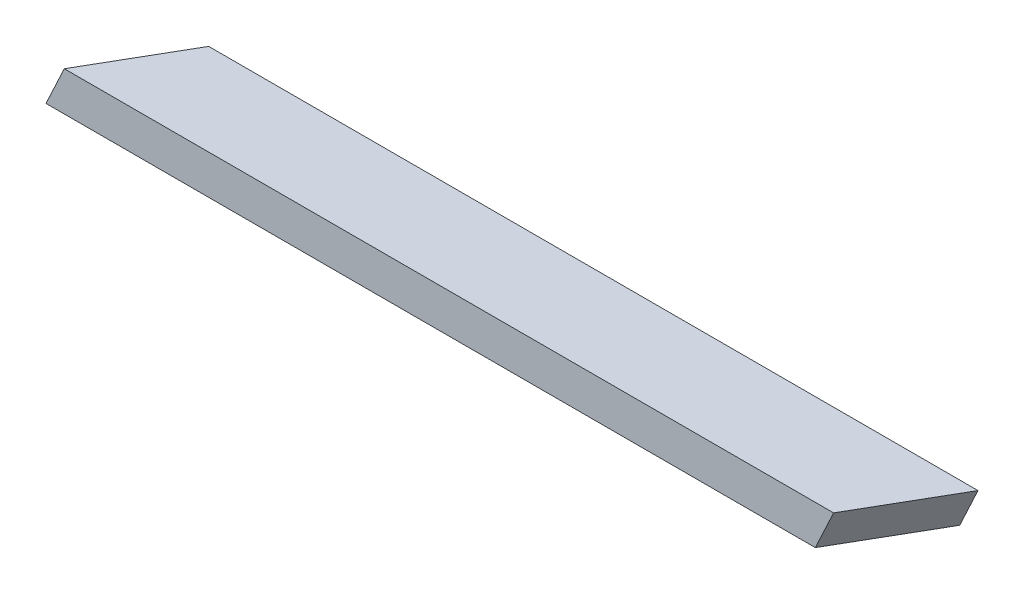
from build123d import *

# Parameters (mm, degrees)
BOSS_EXTRUDE1_DEPTH = 102.652877862


with BuildPart() as part:
    # Sketch11 → Boss-Extrude1 (new, along a direction that is not the sketch's normal)
    with BuildSketch(Plane.XY.offset(44.45)):
        Polygon((-424.916438931, 0), (322.263561069, 0), (322.263561069, 38.1), (-407.150117155, 38.1), align=None)
        Polygon((322.263561069, 0), (340.029882845, 38.1), (322.263561069, 38.1), align=None)
    extrude(amount=-BOSS_EXTRUDE1_DEPTH, dir=(-0.5000000000000009, 0, 0.8660254037844382))


solid = part.part
